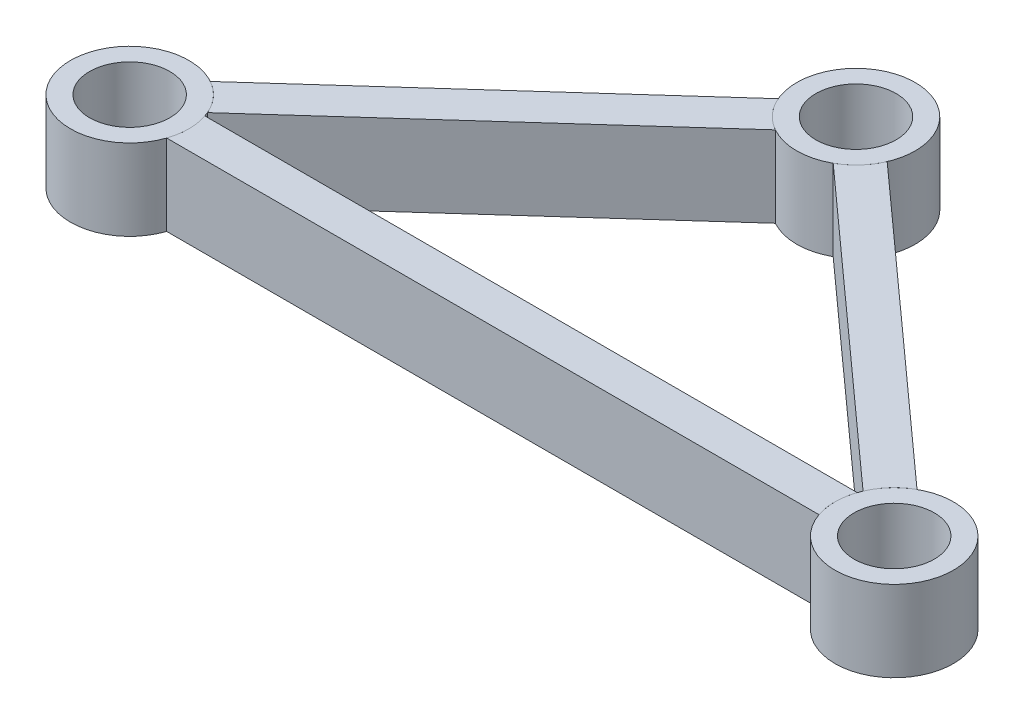
from build123d import *

# Parameters (mm, degrees)
SKETCH2_R                            = 9.3
SKETCH2_R_2                          = 6.3
BOSS_EXTRUDE1_DEPTH                  = 6.35
BOSS_EXTRUDE1_2_DEPTH                = 6.35
BOSS_EXTRUDE1_3_DEPTH                = 6.35
BOSS_EXTRUDE3_REACH                  = 80.489
BOSS_EXTRUDE3_END_RADIUS             = 9.3
SKETCH8_W                            = 6
SKETCH8_H                            = 12.7
BOSS_EXTRUDE3_DIRECTION_2_REACH      = 80.489
BOSS_EXTRUDE3_DIRECTION_2_END_RADIUS = 9.3
BOSS_EXTRUDE4_REACH                  = 88.98
BOSS_EXTRUDE4_END_RADIUS             = 9.3
SKETCH4_W                            = 6
SKETCH4_H                            = 12.7
BOSS_EXTRUDE4_DIRECTION_2_REACH      = 88.98
BOSS_EXTRUDE4_DIRECTION_2_END_RADIUS = 9.3
BOSS_EXTRUDE5_REACH                  = 88.98
BOSS_EXTRUDE5_END_RADIUS             = 9.3
SKETCH3_W                            = 6
SKETCH3_H                            = 12.7
BOSS_EXTRUDE5_DIRECTION_2_REACH      = 88.98
BOSS_EXTRUDE5_DIRECTION_2_END_RADIUS = 9.3


with BuildPart() as part:
    # Sketch2 → Boss-Extrude1 (new, symmetric)
    with BuildSketch(Plane(origin=(0, 0, 0), x_dir=(1, 0, 0), z_dir=(0, 1, 0))):
        with Locations(Location((60, -27, 0), (0, 0, 270))):
            Circle(SKETCH2_R)
        with Locations(Location((60, -27, 0), (0, 0, 270))):
            Circle(SKETCH2_R_2, mode=Mode.SUBTRACT)
    extrude(amount=BOSS_EXTRUDE1_DEPTH, both=True)


with BuildPart() as body_2:
    # Sketch2 → Boss-Extrude1 2 (new, symmetric)
    with BuildSketch(Plane(origin=(0, 0, 0), x_dir=(1, 0, 0), z_dir=(0, 1, 0))):
        with Locations(Location((0, 27, 0), (0, 0, 270))):
            Circle(SKETCH2_R)
        with Locations(Location((0, 27, 0), (0, 0, 270))):
            Circle(SKETCH2_R_2, mode=Mode.SUBTRACT)
    extrude(amount=BOSS_EXTRUDE1_2_DEPTH, both=True)


with BuildPart() as body_3:
    # Sketch2 → Boss-Extrude1 3 (new, symmetric)
    with BuildSketch(Plane(origin=(0, 0, 0), x_dir=(1, 0, 0), z_dir=(0, 1, 0))):
        with Locations(Location((-60, -27, 0), (0, 0, 270))):
            Circle(SKETCH2_R)
        with Locations(Location((-60, -27, 0), (0, 0, 270))):
            Circle(SKETCH2_R_2, mode=Mode.SUBTRACT)
    extrude(amount=BOSS_EXTRUDE1_3_DEPTH, both=True)


with BuildPart() as body_4:
    # Boss-Extrude3: up to this cylinder (the profile starts outside it)
    boss_extrude3_end = Plane(origin=(60, 0, 27), z_dir=(0, -1, 0)) * Cylinder(BOSS_EXTRUDE3_END_RADIUS, 180.578, mode=Mode.PRIVATE)
    # Sketch8 → Boss-Extrude3 (new, up to the surface)
    with BuildSketch(Plane(origin=(0, 0, 0), x_dir=(0, 0, -1), z_dir=(1, 0, 0)), mode=Mode.PRIVATE) as boss_extrude3_sk1:
        with Locations((-27, 0)):
            Rectangle(SKETCH8_W, SKETCH8_H)
    boss_extrude3_tool1 = extrude(boss_extrude3_sk1.sketch, amount=BOSS_EXTRUDE3_REACH, mode=Mode.PRIVATE) - boss_extrude3_end
    add(boss_extrude3_tool1.solids().sort_by_distance((0, 0, 27))[0])

    # Boss-Extrude3 direction 2: up to this cylinder (the profile starts outside it)
    boss_extrude3_direction_2_end = Plane(origin=(-60, 0, 27), z_dir=(0, -1, 0)) * Cylinder(BOSS_EXTRUDE3_DIRECTION_2_END_RADIUS, 180.578, mode=Mode.PRIVATE)
    # Sketch8 → Boss-Extrude3 direction 2 (add, up to the surface)
    with BuildSketch(Plane(origin=(0, 0, 0), x_dir=(0, 0, -1), z_dir=(1, 0, 0)), mode=Mode.PRIVATE) as boss_extrude3_direction_2_sk1:
        with Locations((-27, 0)):
            Rectangle(SKETCH8_W, SKETCH8_H)
    boss_extrude3_direction_2_tool1 = extrude(boss_extrude3_direction_2_sk1.sketch, amount=-BOSS_EXTRUDE3_DIRECTION_2_REACH, mode=Mode.PRIVATE) - boss_extrude3_direction_2_end
    add(boss_extrude3_direction_2_tool1.solids().sort_by_distance((0, 0, 27))[0])


with BuildPart() as body_5:
    # Boss-Extrude4: up to this cylinder (the profile starts outside it)
    boss_extrude4_end = Plane(origin=(-60, 0, 27), z_dir=(0, -1, 0)) * Cylinder(BOSS_EXTRUDE4_END_RADIUS, 197.56, mode=Mode.PRIVATE)
    # Sketch4 → Boss-Extrude4 (new, up to the surface)
    with BuildSketch(Plane(origin=(6.512778805, 0, -5.861500924), x_dir=(0.6689647316224497, 0, 0.7432941462471663), z_dir=(-0.7432941462471663, 0, 0.6689647316224497)), mode=Mode.PRIVATE) as boss_extrude4_sk1:
        with Locations((-20.068941949, 0)):
            Rectangle(SKETCH4_W, SKETCH4_H)
    boss_extrude4_tool1 = extrude(boss_extrude4_sk1.sketch, amount=BOSS_EXTRUDE4_REACH, mode=Mode.PRIVATE) - boss_extrude4_end
    add(boss_extrude4_tool1.solids().sort_by_distance((-6.912636, 0, -20.778628))[0])

    # Boss-Extrude4 direction 2: up to this cylinder (the profile starts outside it)
    boss_extrude4_direction_2_end = Plane(origin=(0, 0, -27), z_dir=(0, -1, 0)) * Cylinder(BOSS_EXTRUDE4_DIRECTION_2_END_RADIUS, 197.56, mode=Mode.PRIVATE)
    # Sketch4 → Boss-Extrude4 direction 2 (add, up to the surface)
    with BuildSketch(Plane(origin=(6.512778805, 0, -5.861500924), x_dir=(0.6689647316224497, 0, 0.7432941462471663), z_dir=(-0.7432941462471663, 0, 0.6689647316224497)), mode=Mode.PRIVATE) as boss_extrude4_direction_2_sk1:
        with Locations((-20.068941949, 0)):
            Rectangle(SKETCH4_W, SKETCH4_H)
    boss_extrude4_direction_2_tool1 = extrude(boss_extrude4_direction_2_sk1.sketch, amount=-BOSS_EXTRUDE4_DIRECTION_2_REACH, mode=Mode.PRIVATE) - boss_extrude4_direction_2_end
    add(boss_extrude4_direction_2_tool1.solids().sort_by_distance((-6.912636, 0, -20.778628))[0])
    add(boss_extrude4_direction_2_tool1.solids().sort_by_distance((-6.912636, 0, -20.778628))[1])


with BuildPart() as body_6:
    # Boss-Extrude5: up to this cylinder (the profile starts outside it)
    boss_extrude5_end = Plane(origin=(60, 0, 27), z_dir=(0, -1, 0)) * Cylinder(BOSS_EXTRUDE5_END_RADIUS, 197.56, mode=Mode.PRIVATE)
    # Sketch3 → Boss-Extrude5 (new, up to the surface)
    with BuildSketch(Plane(origin=(-6.512778805, 0, -5.861500924), x_dir=(0.6689647316224495, 0, -0.7432941462471665), z_dir=(0.7432941462471665, 0, 0.6689647316224495)), mode=Mode.PRIVATE) as boss_extrude5_sk1:
        with Locations((20.068941949, 0)):
            Rectangle(SKETCH3_W, SKETCH3_H)
    boss_extrude5_tool1 = extrude(boss_extrude5_sk1.sketch, amount=BOSS_EXTRUDE5_REACH, mode=Mode.PRIVATE) - boss_extrude5_end
    add(boss_extrude5_tool1.solids().sort_by_distance((6.912636, 0, -20.778628))[0])

    # Boss-Extrude5 direction 2: up to this cylinder (the profile starts outside it)
    boss_extrude5_direction_2_end = Plane(origin=(0, 0, -27), z_dir=(0, -1, 0)) * Cylinder(BOSS_EXTRUDE5_DIRECTION_2_END_RADIUS, 197.56, mode=Mode.PRIVATE)
    # Sketch3 → Boss-Extrude5 direction 2 (add, up to the surface)
    with BuildSketch(Plane(origin=(-6.512778805, 0, -5.861500924), x_dir=(0.6689647316224495, 0, -0.7432941462471665), z_dir=(0.7432941462471665, 0, 0.6689647316224495)), mode=Mode.PRIVATE) as boss_extrude5_direction_2_sk1:
        with Locations((20.068941949, 0)):
            Rectangle(SKETCH3_W, SKETCH3_H)
    boss_extrude5_direction_2_tool1 = extrude(boss_extrude5_direction_2_sk1.sketch, amount=-BOSS_EXTRUDE5_DIRECTION_2_REACH, mode=Mode.PRIVATE) - boss_extrude5_direction_2_end
    add(boss_extrude5_direction_2_tool1.solids().sort_by_distance((6.912636, 0, -20.778628))[0])
    add(boss_extrude5_direction_2_tool1.solids().sort_by_distance((6.912636, 0, -20.778628))[1])


solid = Compound([part.part, body_2.part, body_3.part, body_4.part, body_5.part, body_6.part])
